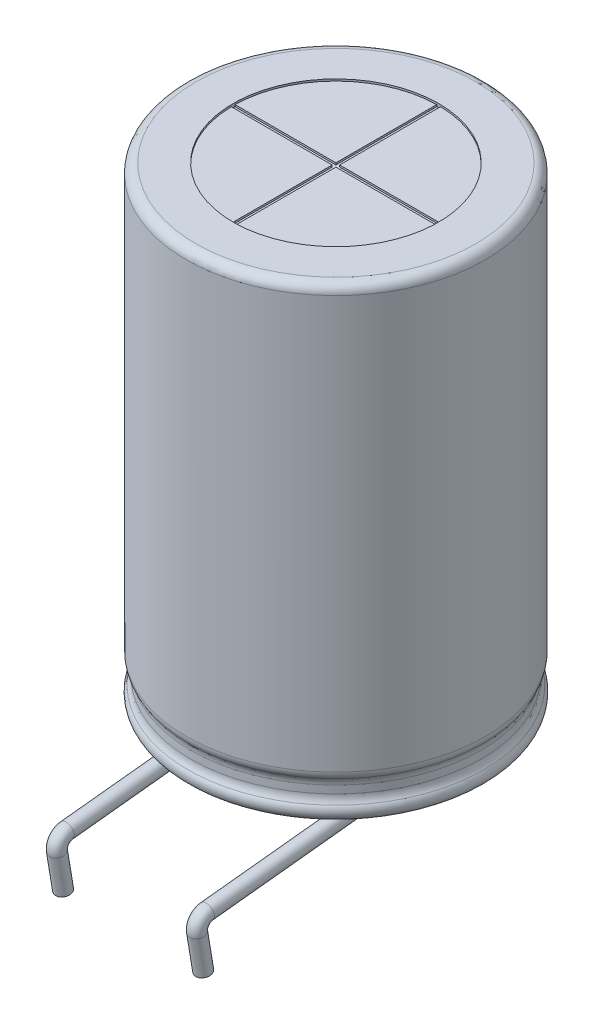
from build123d import *

# Parameters (mm, degrees)
SKETCH2_R             = 5.5
CUT_EXTRUDE1_DEPTH    = 0.1
CUT_EXTRUDE2_DEPTH    = 0.1
CORTAR_EXTRUIR1_START = -0.25
CROQUIS4_R            = 5.5
CORTAR_EXTRUIR1_DEPTH = 0.25
FILLET1_R             = 0.5
CROQUIS8_R            = 0.4


with BuildPart() as part:
    # Sketch1 → Revolve1 (revolve)
    with BuildSketch(Plane.XY):
        with BuildLine():
            Line((8, 25), (0, 25))
            Line((0, 25), (0, 0))
            Line((0, 0), (8, 0))
            ThreePointArc((8, 0), (8.092932458, 0.406232629), (7.928060317, 0.788957816))
            ThreePointArc((7.928060317, 0.788957816), (7.803725589, 0.995469347), (7.760416667, 1.232599004))
            Line((7.760416667, 1.232599004), (7.760416667, 1.642400996))
            ThreePointArc((7.760416667, 1.642400996), (7.791064683, 1.842850794), (7.880208333, 2.024984899))
            ThreePointArc((7.880208333, 2.024984899), (7.969351983, 2.207119004), (8, 2.407568802))
            Line((8, 2.407568802), (8, 25))
        make_face()
    revolve(axis=Axis((0, 25, 0), (0, -1, 0)))

    # Sketch2 → Cut-Extrude1 (cut)
    with BuildSketch(Plane(origin=(0, 25, 0), x_dir=(-1, 0, 0), z_dir=(0, 1, 0))):
        with Locations(Location((0, 0, 0), (0, 0, 270))):
            Circle(SKETCH2_R)
    extrude(amount=-CUT_EXTRUDE1_DEPTH, mode=Mode.SUBTRACT)

    # Sketch3 → Cut-Extrude2 (cut)
    with BuildSketch(Plane(origin=(0, 24.9, 0), x_dir=(-1, 0, 0), z_dir=(0, 1, 0))):
        with BuildLine():
            Line((-5.499090834, -0.1), (-0.1, -0.1))
            Line((-0.1, -0.1), (-0.1, -5.499090834))
            ThreePointArc((-0.1, -5.499090834), (-0.050002066, -5.499772704), (0, -5.5))
            ThreePointArc((0, -5.5), (0.050002066, -5.499772704), (0.1, -5.499090834))
            Line((0.1, -5.499090834), (0.1, -0.1))
            Line((0.1, -0.1), (5.499090834, -0.1))
            ThreePointArc((5.499090834, -0.1), (5.499772704, -0.050002066), (5.5, 0))
            ThreePointArc((5.5, 0), (5.499772704, 0.050002066), (5.499090834, 0.1))
            Line((5.499090834, 0.1), (0.1, 0.1))
            Line((0.1, 0.1), (0.1, 5.499090834))
            ThreePointArc((0.1, 5.499090834), (0.050002066, 5.499772704), (0, 5.5))
            ThreePointArc((0, 5.5), (-0.050002066, 5.499772704), (-0.1, 5.499090834))
            Line((-0.1, 5.499090834), (-0.1, 0.1))
            Line((-0.1, 0.1), (-5.499090834, 0.1))
            ThreePointArc((-5.499090834, 0.1), (-5.499772704, 0.050002066), (-5.5, 0))
            ThreePointArc((-5.5, 0), (-5.499772704, -0.050002066), (-5.499090834, -0.1))
        make_face()
    extrude(amount=-CUT_EXTRUDE2_DEPTH, mode=Mode.SUBTRACT)

    # Croquis4 → Cortar-Extruir1 (cut)
    with BuildSketch(Plane.XZ.offset(CORTAR_EXTRUIR1_START)):
        with Locations(Location((0, 0, 0), (0, 0, 88.95820115))):
            Circle(CROQUIS4_R)
    extrude(amount=CORTAR_EXTRUIR1_DEPTH, mode=Mode.SUBTRACT)

    # Fillet1
    fillet1_edges = [part.edges().sort_by_distance(p)[0] for p in [
        (-8, 25, 0),
        (-8, 0, 0),
    ]]
    fillet(fillet1_edges, radius=FILLET1_R)

    # Barrer6: sweep along a path in Croquis2
    with BuildLine(Plane(origin=(3.75, 0, 0), x_dir=(0, 0, -1), z_dir=(1, 0, 0))) as barrer6_path:
        Line((0, 0.25), (0, 0))
        ThreePointArc((0, 0), (-0.384316818, -1.002622081), (-1.340334716, -1.491478125))
        Line((-1.340334716, -1.491478125), (-10.651137541, -2.488215488))
        ThreePointArc((-10.651137541, -2.488215488), (-11.06505376, -2.721868669), (-11.179134431, -3.1832861))
        Line((-11.179134431, -3.1832861), (-10.850869892, -5.15616278))
    # Croquis8 → Barrer6 (sweep)
    with BuildSketch(Plane.XZ.offset(-0.25)):
        with Locations((3.75, 0)):
            Circle(CROQUIS8_R)
    barrer6 = sweep(path=barrer6_path.line)

    # Mirror1: Barrer6 across plane
    add(barrer6.mirror(Plane(origin=(0, 0, 0), x_dir=(0, 0, 1), z_dir=(1, 0, 0))))


solid = part.part
